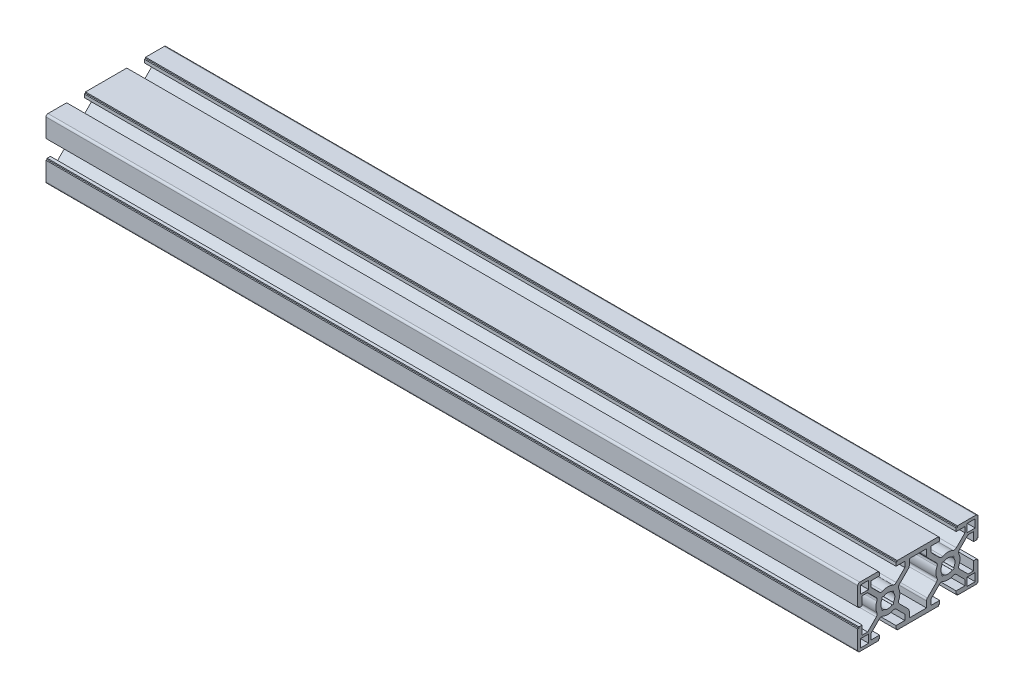
from build123d import *

# Parameters (mm, degrees)
SKETCH1_W           = 4
SKETCH1_H           = 4
BOSS_EXTRUDE1_DEPTH = 405


with BuildPart() as part:
    # Sketch1 → Boss-Extrude1 (new body)
    with BuildSketch(Plane(origin=(405, 0, 0), x_dir=(0, 0, -1), z_dir=(1, 0, 0))):
        with BuildLine():
            Line((-10.803382818, -20.752252101), (-6.5, -25.055634919))
            Line((-6.5, -25.055634919), (-6.5, -27.8))
            Line((-6.5, -27.8), (-10.9, -27.8))
            Line((-10.9, -27.8), (-10.9, -29.4))
            Line((-10.9, -29.4), (-10.3, -29.4))
            Line((-10.3, -29.4), (-10.3, -30))
            Line((-10.3, -30), (-1, -30))
            ThreePointArc((-1, -30), (-0.292893219, -29.707106781), (0, -29))
            Line((0, -29), (0, -19.7))
            Line((0, -19.7), (-0.6, -19.7))
            Line((-0.6, -19.7), (-0.6, -19.1))
            Line((-0.6, -19.1), (-2.2, -19.1))
            Line((-2.2, -19.1), (-2.2, -23.5))
            Line((-2.2, -23.5), (-4.944365081, -23.5))
            Line((-4.944365081, -23.5), (-9.247747899, -19.196617182))
            ThreePointArc((-9.247747899, -19.196617182), (-9.66365027, -18.400083987), (-9.549670182, -17.508765608))
            ThreePointArc((-9.549670182, -17.508765608), (-9, -15), (-9.549670182, -12.491234392))
            ThreePointArc((-9.549670182, -12.491234392), (-9.66365027, -11.599916013), (-9.247747899, -10.803382818))
            Line((-9.247747899, -10.803382818), (-4.944365081, -6.5))
            Line((-4.944365081, -6.5), (-2.2, -6.5))
            Line((-2.2, -6.5), (-2.2, -10.9))
            Line((-2.2, -10.9), (-0.6, -10.9))
            Line((-0.6, -10.9), (-0.6, -10.3))
            Line((-0.6, -10.3), (0, -10.3))
            Line((0, -10.3), (0, -1))
            ThreePointArc((0, -1), (-0.292893219, -0.292893219), (-1, 0))
            Line((-1, 0), (-10.3, 0))
            Line((-10.3, 0), (-10.3, -0.6))
            Line((-10.3, -0.6), (-10.9, -0.6))
            Line((-10.9, -0.6), (-10.9, -2.2))
            Line((-10.9, -2.2), (-6.5, -2.2))
            Line((-6.5, -2.2), (-6.5, -4.944365081))
            Line((-6.5, -4.944365081), (-10.803382818, -9.247747899))
            ThreePointArc((-10.803382818, -9.247747899), (-11.599916013, -9.66365027), (-12.491234392, -9.549670182))
            ThreePointArc((-12.491234392, -9.549670182), (-15, -9), (-17.508765608, -9.549670182))
            ThreePointArc((-17.508765608, -9.549670182), (-18.400083987, -9.66365027), (-19.196617182, -9.247747899))
            Line((-19.196617182, -9.247747899), (-23.5, -4.944365081))
            Line((-23.5, -4.944365081), (-23.5, -2.2))
            Line((-23.5, -2.2), (-19.1, -2.2))
            Line((-19.1, -2.2), (-19.1, -0.6))
            Line((-19.1, -0.6), (-19.7, -0.6))
            Line((-19.7, -0.6), (-19.7, 0))
            Line((-19.7, 0), (-40.3, 0))
            Line((-40.3, 0), (-40.3, -0.6))
            Line((-40.3, -0.6), (-40.9, -0.6))
            Line((-40.9, -0.6), (-40.9, -2.2))
            Line((-40.9, -2.2), (-36.5, -2.2))
            Line((-36.5, -2.2), (-36.5, -4.944365081))
            Line((-36.5, -4.944365081), (-40.803382818, -9.247747899))
            ThreePointArc((-40.803382818, -9.247747899), (-41.599916013, -9.66365027), (-42.491234392, -9.549670182))
            ThreePointArc((-42.491234392, -9.549670182), (-45, -9), (-47.508765608, -9.549670182))
            ThreePointArc((-47.508765608, -9.549670182), (-48.400083987, -9.66365027), (-49.196617182, -9.247747899))
            Line((-49.196617182, -9.247747899), (-53.5, -4.944365081))
            Line((-53.5, -4.944365081), (-53.5, -2.2))
            Line((-53.5, -2.2), (-49.1, -2.2))
            Line((-49.1, -2.2), (-49.1, -0.6))
            Line((-49.1, -0.6), (-49.7, -0.6))
            Line((-49.7, -0.6), (-49.7, 0))
            Line((-49.7, 0), (-59, 0))
            ThreePointArc((-59, 0), (-59.707106781, -0.292893219), (-60, -1))
            Line((-60, -1), (-60, -10.3))
            Line((-60, -10.3), (-59.4, -10.3))
            Line((-59.4, -10.3), (-59.4, -10.9))
            Line((-59.4, -10.9), (-57.8, -10.9))
            Line((-57.8, -10.9), (-57.8, -6.5))
            Line((-57.8, -6.5), (-55.055634919, -6.5))
            Line((-55.055634919, -6.5), (-50.752252101, -10.803382818))
            ThreePointArc((-50.752252101, -10.803382818), (-50.33634973, -11.599916013), (-50.450329818, -12.491234392))
            ThreePointArc((-50.450329818, -12.491234392), (-51, -15), (-50.450329818, -17.508765608))
            ThreePointArc((-50.450329818, -17.508765608), (-50.33634973, -18.400083987), (-50.752252101, -19.196617182))
            Line((-50.752252101, -19.196617182), (-55.055634919, -23.5))
            Line((-55.055634919, -23.5), (-57.8, -23.5))
            Line((-57.8, -23.5), (-57.8, -19.1))
            Line((-57.8, -19.1), (-59.4, -19.1))
            Line((-59.4, -19.1), (-59.4, -19.7))
            Line((-59.4, -19.7), (-60, -19.7))
            Line((-60, -19.7), (-60, -29))
            ThreePointArc((-60, -29), (-59.707106781, -29.707106781), (-59, -30))
            Line((-59, -30), (-49.7, -30))
            Line((-49.7, -30), (-49.7, -29.4))
            Line((-49.7, -29.4), (-49.1, -29.4))
            Line((-49.1, -29.4), (-49.1, -27.8))
            Line((-49.1, -27.8), (-53.5, -27.8))
            Line((-53.5, -27.8), (-53.5, -25.055634919))
            Line((-53.5, -25.055634919), (-49.196617182, -20.752252101))
            ThreePointArc((-49.196617182, -20.752252101), (-48.400083987, -20.33634973), (-47.508765608, -20.450329818))
            ThreePointArc((-47.508765608, -20.450329818), (-45, -21), (-42.491234392, -20.450329818))
            ThreePointArc((-42.491234392, -20.450329818), (-41.599916013, -20.33634973), (-40.803382818, -20.752252101))
            Line((-40.803382818, -20.752252101), (-36.5, -25.055634919))
            Line((-36.5, -25.055634919), (-36.5, -27.8))
            Line((-36.5, -27.8), (-40.9, -27.8))
            Line((-40.9, -27.8), (-40.9, -29.4))
            Line((-40.9, -29.4), (-40.3, -29.4))
            Line((-40.3, -29.4), (-40.3, -30))
            Line((-40.3, -30), (-19.7, -30))
            Line((-19.7, -30), (-19.7, -29.4))
            Line((-19.7, -29.4), (-19.1, -29.4))
            Line((-19.1, -29.4), (-19.1, -27.8))
            Line((-19.1, -27.8), (-23.5, -27.8))
            Line((-23.5, -27.8), (-23.5, -25.055634919))
            Line((-23.5, -25.055634919), (-19.196617182, -20.752252101))
            ThreePointArc((-19.196617182, -20.752252101), (-18.400083987, -20.33634973), (-17.508765608, -20.450329818))
            ThreePointArc((-17.508765608, -20.450329818), (-15, -21), (-12.491234392, -20.450329818))
            ThreePointArc((-12.491234392, -20.450329818), (-11.599916013, -20.33634973), (-10.803382818, -20.752252101))
        make_face()
        with Locations((-56.6, -26.6)):
            Rectangle(SKETCH1_W, SKETCH1_H, mode=Mode.SUBTRACT)
        with Locations((-56.6, -3.4)):
            Rectangle(SKETCH1_W, SKETCH1_H, mode=Mode.SUBTRACT)
        with Locations((-3.4, -26.6)):
            Rectangle(SKETCH1_W, SKETCH1_H, mode=Mode.SUBTRACT)
        with Locations((-3.4, -3.4)):
            Rectangle(SKETCH1_W, SKETCH1_H, mode=Mode.SUBTRACT)
        with BuildLine():
            Line((-39.247747899, -10.803382818), (-34.739339828, -6.294974747))
            ThreePointArc((-34.739339828, -6.294974747), (-34.414180701, -5.808339724), (-34.3, -5.234314575))
            Line((-34.3, -5.234314575), (-34.3, -2.2))
            Line((-34.3, -2.2), (-25.7, -2.2))
            Line((-25.7, -2.2), (-25.7, -5.234314575))
            ThreePointArc((-25.7, -5.234314575), (-25.585819299, -5.808339724), (-25.260660172, -6.294974747))
            Line((-25.260660172, -6.294974747), (-20.752252101, -10.803382818))
            ThreePointArc((-20.752252101, -10.803382818), (-20.33634973, -11.599916013), (-20.450329818, -12.491234392))
            ThreePointArc((-20.450329818, -12.491234392), (-21, -15), (-20.450329818, -17.508765608))
            ThreePointArc((-20.450329818, -17.508765608), (-20.33634973, -18.400083987), (-20.752252101, -19.196617182))
            Line((-20.752252101, -19.196617182), (-25.260660172, -23.705025253))
            ThreePointArc((-25.260660172, -23.705025253), (-25.585819299, -24.191660276), (-25.7, -24.765685425))
            Line((-25.7, -24.765685425), (-25.7, -27.8))
            Line((-25.7, -27.8), (-34.3, -27.8))
            Line((-34.3, -27.8), (-34.3, -24.765685425))
            ThreePointArc((-34.3, -24.765685425), (-34.414180701, -24.191660276), (-34.739339828, -23.705025253))
            Line((-34.739339828, -23.705025253), (-39.247747899, -19.196617182))
            ThreePointArc((-39.247747899, -19.196617182), (-39.66365027, -18.400083987), (-39.549670182, -17.508765608))
            ThreePointArc((-39.549670182, -17.508765608), (-39, -15), (-39.549670182, -12.491234392))
            ThreePointArc((-39.549670182, -12.491234392), (-39.66365027, -11.599916013), (-39.247747899, -10.803382818))
        make_face(mode=Mode.SUBTRACT)
        with BuildLine():
            ThreePointArc((-47.802270236, -17.096969605), (-48.5, -15), (-47.802270236, -12.903030395))
            ThreePointArc((-47.802270236, -12.903030395), (-47.828427125, -12.171572875), (-47.096969605, -12.197729764))
            ThreePointArc((-47.096969605, -12.197729764), (-45, -11.5), (-42.903030395, -12.197729764))
            ThreePointArc((-42.903030395, -12.197729764), (-42.171572875, -12.171572875), (-42.197729764, -12.903030395))
            ThreePointArc((-42.197729764, -12.903030395), (-41.5, -15), (-42.197729764, -17.096969605))
            ThreePointArc((-42.197729764, -17.096969605), (-42.171572875, -17.828427125), (-42.903030395, -17.802270236))
            ThreePointArc((-42.903030395, -17.802270236), (-45, -18.5), (-47.096969605, -17.802270236))
            ThreePointArc((-47.096969605, -17.802270236), (-47.828427125, -17.828427125), (-47.802270236, -17.096969605))
        make_face(mode=Mode.SUBTRACT)
        with BuildLine():
            ThreePointArc((-12.197729764, -12.903030395), (-11.5, -15), (-12.197729764, -17.096969605))
            ThreePointArc((-12.197729764, -17.096969605), (-12.171572875, -17.828427125), (-12.903030395, -17.802270236))
            ThreePointArc((-12.903030395, -17.802270236), (-15, -18.5), (-17.096969605, -17.802270236))
            ThreePointArc((-17.096969605, -17.802270236), (-17.828427125, -17.828427125), (-17.802270236, -17.096969605))
            ThreePointArc((-17.802270236, -17.096969605), (-18.5, -15), (-17.802270236, -12.903030395))
            ThreePointArc((-17.802270236, -12.903030395), (-17.828427125, -12.171572875), (-17.096969605, -12.197729764))
            ThreePointArc((-17.096969605, -12.197729764), (-15, -11.5), (-12.903030395, -12.197729764))
            ThreePointArc((-12.903030395, -12.197729764), (-12.171572875, -12.171572875), (-12.197729764, -12.903030395))
        make_face(mode=Mode.SUBTRACT)
    extrude(amount=-BOSS_EXTRUDE1_DEPTH)


solid = part.part
